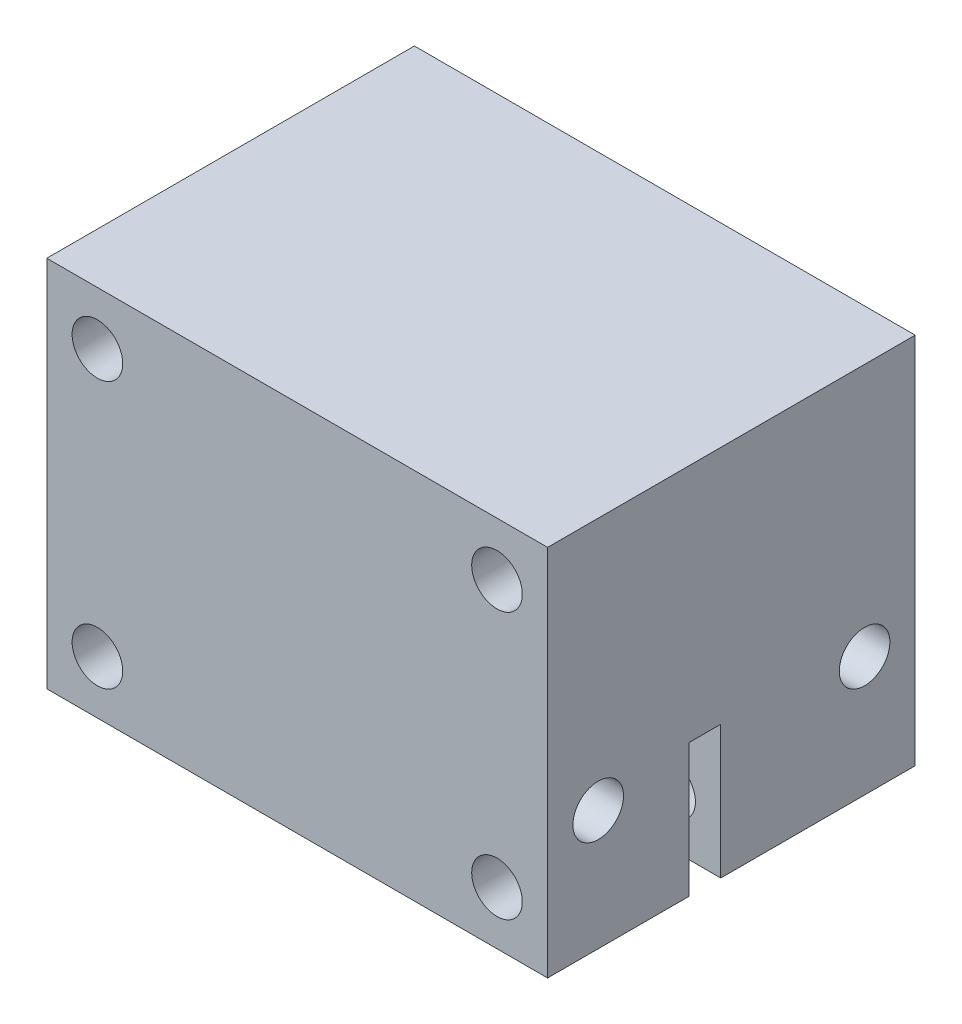
from build123d import *

# Parameters (mm, degrees)
SKETCH_1_W          = 37.6
SKETCH_1_H          = 28
SKETCH_1_R          = 1.9
EXTRUDE_1_DEPTH     = 27.6
SKETCH_2_R          = 1.9
SKETCH_2_W          = 2.4
SKETCH_2_H          = 10
CUT_EXTRUDE_1_DEPTH = 55.401470568


with BuildPart() as part:
    # 草图1 → 凸台-拉伸1 (new body)
    with BuildSketch(Plane.XY):
        with Locations((18.8, 14)):
            Rectangle(SKETCH_1_W, SKETCH_1_H)
        with Locations(Location((3.8, 24, 0), (0, 0, 180))):
            Circle(SKETCH_1_R, mode=Mode.SUBTRACT)
        with Locations(Location((33.8, 24, 0), (0, 0, 180))):
            Circle(SKETCH_1_R, mode=Mode.SUBTRACT)
        with Locations(Location((33.8, 4, 0), (0, 0, 180))):
            Circle(SKETCH_1_R, mode=Mode.SUBTRACT)
        with Locations(Location((3.8, 4, 0), (0, 0, 180))):
            Circle(SKETCH_1_R, mode=Mode.SUBTRACT)
    extrude(amount=EXTRUDE_1_DEPTH)

    # 草图2 → 切除-拉伸1 (cut, through all)
    with BuildSketch(Plane(origin=(37.6, 0, 0), x_dir=(0, 0, -1), z_dir=(1, 0, 0))):
        with Locations(Location((-23.8, 9, 0), (0, 0, 90))):
            Circle(SKETCH_2_R)
        with Locations(Location((-3.8, 9, 0), (0, 0, 90))):
            Circle(SKETCH_2_R)
        with Locations((-15.8, 5)):
            Rectangle(SKETCH_2_W, SKETCH_2_H)
    extrude(amount=-CUT_EXTRUDE_1_DEPTH, mode=Mode.SUBTRACT)


solid = part.part
